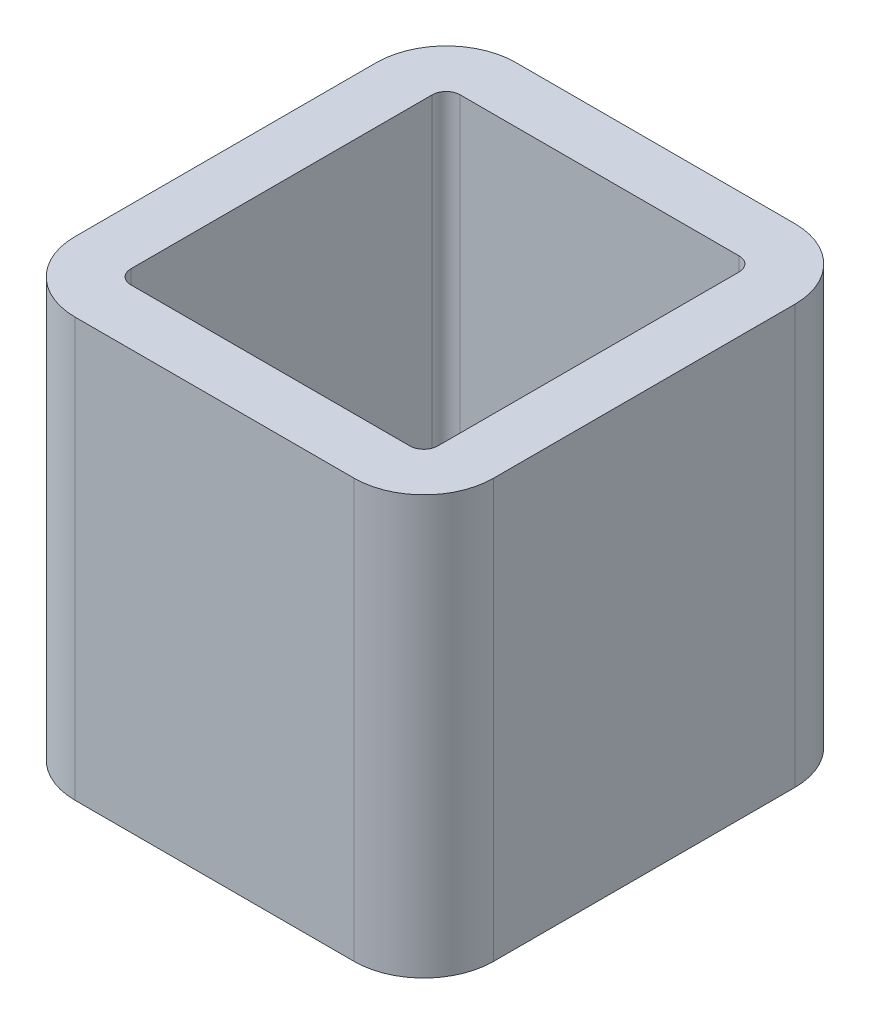
from build123d import *

# Parameters (mm, degrees)
SKETCH1_W           = 300
SKETCH1_H           = 316
BOSS_EXTRUDE1_DEPTH = 300
FILLET1_R           = 50
SHELL1_T            = -40


with BuildPart() as part:
    # Sketch1 → Boss-Extrude1 (new body)
    with BuildSketch(Plane(origin=(0, 0, 0), x_dir=(1, 0, 0), z_dir=(0, 1, 0))):
        Rectangle(SKETCH1_W, SKETCH1_H)
    extrude(amount=BOSS_EXTRUDE1_DEPTH)

    # Fillet1
    fillet1_edges = [part.edges().sort_by_distance(p)[0] for p in [
        (-150, 150, -158),
        (150, 150, -158),
        (150, 150, 158),
        (-150, 150, 158),
    ]]
    fillet(fillet1_edges, radius=FILLET1_R)

    # Shell1
    shell1_openings = [part.faces().sort_by_distance(p)[0] for p in [
        (0, 300, 0),
        (0, 0, 0),
    ]]
    offset(amount=SHELL1_T, openings=shell1_openings, kind=Kind.INTERSECTION)


solid = part.part
